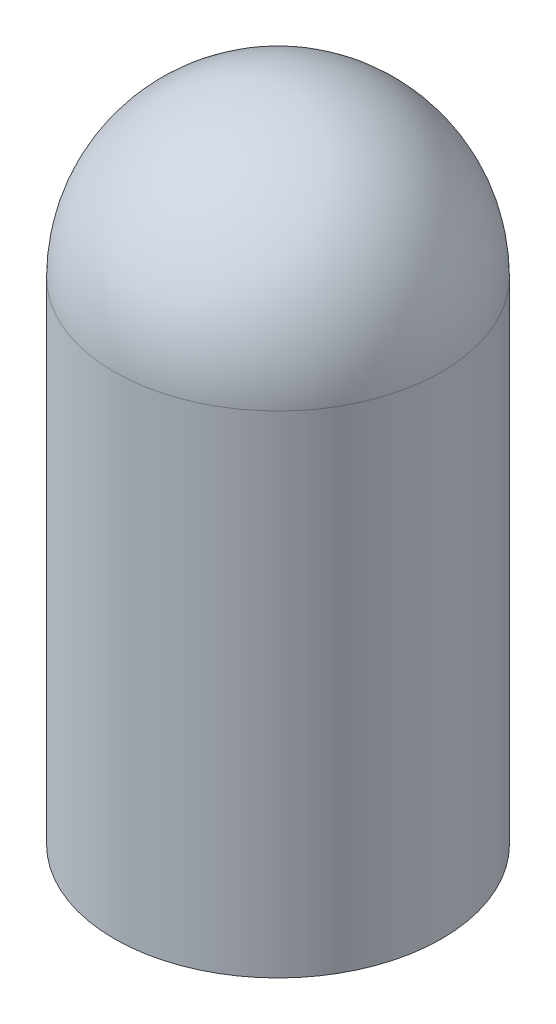
from build123d import *

# Parameters (mm, degrees)
SKETCH1_R           = 5
BOSS_EXTRUDE1_DEPTH = 20
FILLET1_R           = 5


with BuildPart() as part:
    # Sketch1 → Boss-Extrude1 (new body)
    with BuildSketch(Plane(origin=(0, 0, 0), x_dir=(1, 0, 0), z_dir=(0, 1, 0))):
        with Locations(Location((0, 0, 0), (0, 0, 270))):
            Circle(SKETCH1_R)
    extrude(amount=BOSS_EXTRUDE1_DEPTH)

    # Fillet1
    fillet1_edges = [part.edges().sort_by_distance(p)[0] for p in [
        (0, 20, -5),
    ]]
    fillet(fillet1_edges, radius=FILLET1_R)


solid = part.part
